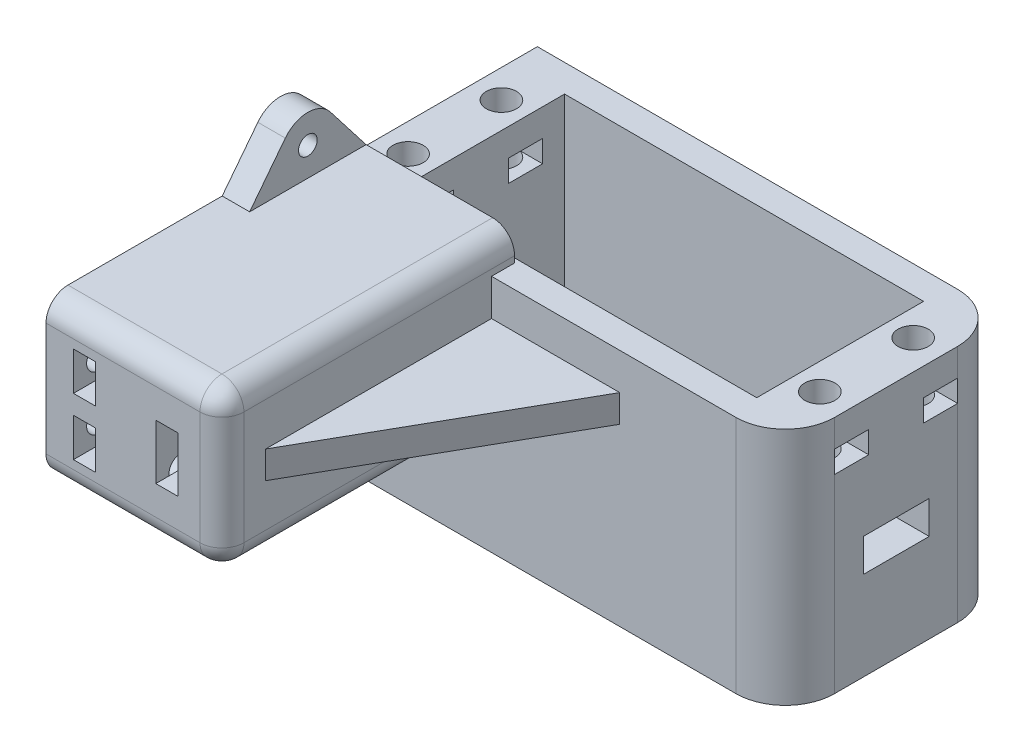
from build123d import *

# Parameters (mm, degrees)
BOSS_EXTRUDE1_DEPTH  = 12.572663867
SKETCH3_W            = 65.4
SKETCH3_H            = 30.4
BOSS_EXTRUDE2_DEPTH  = 43.572663867
FILLET1_R            = 9
SKETCH4_R            = 2.75
CUT_EXTRUDE1_DEPTH   = 20
CUT_EXTRUDE2_DEPTH   = 129
SKETCH6_R            = 6.7
CUT_EXTRUDE3_DEPTH   = 129
CUT_EXTRUDE6_DEPTH   = 63
SKETCH8_W            = 26.7
SKETCH8_H            = 1.112336133
BOSS_EXTRUDE3_DEPTH  = 4.2
BOSS_EXTRUDE4_DEPTH  = 41.15
SKETCH10_W           = 32.05
SKETCH10_H           = 5.146663352
BOSS_EXTRUDE5_DEPTH  = 4.2
BOSS_EXTRUDE6_DEPTH  = 23.35
CUT_EXTRUDE7_DEPTH   = 23.35
BOSS_EXTRUDE7_DEPTH  = 5
SKETCH15_W           = 32.05
SKETCH15_H           = 28.624452046
BOSS_EXTRUDE8_DEPTH  = 7.95
FILLET2_R            = 4
FILLET3_R            = 4
SKETCH16_R           = 2.2
CUT_EXTRUDE8_DEPTH   = 20
CUT_EXTRUDE9_DEPTH   = 41
BOSS_EXTRUDE9_DEPTH  = 5
SKETCH19_R           = 2.420474662
CUT_EXTRUDE10_DEPTH  = 5
BOSS_EXTRUDE10_START = -5
SKETCH20_R           = 2.420474662
SKETCH20_R_2         = 1.7
BOSS_EXTRUDE10_DEPTH = 5
SKETCH21_W           = 4
SKETCH21_H           = 10
CUT_EXTRUDE11_DEPTH  = 10


with BuildPart() as part:
    # Sketch2 → Boss-Extrude1 (new body)
    with BuildSketch(Plane.XZ):
        Polygon((-29.5, -30.2), (-32.5, -30.2), (-32.7, -30.2), (-32.7, -27), (-32.7, 0), (-32.7, 0.2), (32.5, 0.2), (32.7, 0.2), (32.900400589, -30.2), align=None)
    extrude(amount=BOSS_EXTRUDE1_DEPTH)

    # Sketch3 → Boss-Extrude2 (add)
    with BuildSketch(Plane(origin=(0, -12.572663867, 0), x_dir=(-1, 0, 0), z_dir=(0, -1, 0))):
        Polygon((-32.7, -5.2), (32.651437537, -5.2), (42.651437537, -5.2), (42.651437537, 30.2), (42.651437537, 35.2), (-32.900400589, 35.2), (-42.900400589, 35.2), (-42.900400589, 30.2), (-42.900400589, -5.2), align=None)
        with Locations((0, 15)):
            Rectangle(SKETCH3_W, SKETCH3_H, mode=Mode.SUBTRACT)
    extrude(amount=-BOSS_EXTRUDE2_DEPTH)

    # Fillet1
    fillet1_edges = [part.edges().sort_by_distance(p)[0] for p in [
        (42.900400589, 9.213668067, -35.2),
        (42.900400589, 9.213668067, 5.2),
    ]]
    fillet(fillet1_edges, radius=FILLET1_R)

    # Sketch4 → Cut-Extrude1 (cut)
    with BuildSketch(Plane(origin=(0, 31, 0), x_dir=(1, 0, 0), z_dir=(0, 1, 0))):
        with Locations(Location((-37.5, 23.5, 0), (0, 0, 270))):
            Circle(SKETCH4_R)
        with Locations(Location((-37.5, 6.5, 0), (0, 0, 270))):
            Circle(SKETCH4_R)
        with Locations(Location((37.5, 6.5, 0), (0, 0, 270))):
            Circle(SKETCH4_R)
        with Locations(Location((37.5, 23.5, 0), (0, 0, 270))):
            Circle(SKETCH4_R)
    extrude(amount=-CUT_EXTRUDE1_DEPTH, mode=Mode.SUBTRACT)

    # Sketch5 → Cut-Extrude2 (cut)
    with BuildSketch(Plane(origin=(42.900400589, 0, 0), x_dir=(0, 0, -1), z_dir=(1, 0, 0))):
        Polygon((6.5, 26), (3.8, 26), (3.8, 22), (10, 22), (10, 26), align=None)
        Polygon((26.2, 26), (23.5, 26), (20, 26), (20, 22), (26.2, 22), align=None)
    extrude(amount=-CUT_EXTRUDE2_DEPTH, mode=Mode.SUBTRACT)

    # Sketch6 → Cut-Extrude3 (cut)
    with BuildSketch(Plane.XZ.offset(12.572663867)):
        with Locations((19.5, -15)):
            Circle(SKETCH6_R)
    extrude(amount=-CUT_EXTRUDE3_DEPTH, mode=Mode.SUBTRACT)

    # Sketch7 → Cut-Extrude6 (cut)
    with BuildSketch(Plane(origin=(42.900400589, 0, 0), x_dir=(0, 0, -1), z_dir=(1, 0, 0))):
        Polygon((21.019628841, 3.612336133), (9.019628841, 3.612336133), (9.019628841, 9.612336133), (15.019628841, 9.612336133), (21.019628841, 9.612336133), align=None)
    extrude(amount=-CUT_EXTRUDE6_DEPTH, mode=Mode.SUBTRACT)

    # Sketch8 → Boss-Extrude3 (add)
    with BuildSketch(Plane.XY.offset(5.2)):
        with Locations((-29.301437537, 31.556168066)):
            Rectangle(SKETCH8_W, SKETCH8_H)
    extrude(amount=-BOSS_EXTRUDE3_DEPTH)

    # Sketch9 → Boss-Extrude4 (add)
    with BuildSketch(Plane.XY.offset(5.2)):
        Polygon((-15.951437537, 11.762336133), (-42.651437537, 11.762336133), (-42.651437537, 7.522211306), (-10.601437537, 7.522211306), (-10.601437537, 11.762336133), (-10.601437537, 31), (-15.601437537, 31), (-15.601437537, 11.762336133), align=None)
        Polygon((-42.651437537, 36.146663352), (-42.651437537, 32.462336133), (-15.601437537, 32.462336133), (-15.601437537, 32.112336133), (-15.601437537, 31), (-10.601437537, 31), (-10.601437537, 32.462336133), (-10.601437537, 36.146663352), align=None)
    extrude(amount=BOSS_EXTRUDE4_DEPTH)

    # Sketch10 → Boss-Extrude5 (add)
    with BuildSketch(Plane(origin=(0, 0, 5.2), x_dir=(-1, 0, 0), z_dir=(0, 0, -1))):
        with Locations((26.626437537, 33.573331676)):
            Rectangle(SKETCH10_W, SKETCH10_H)
    extrude(amount=BOSS_EXTRUDE5_DEPTH)

    # Sketch12 → Boss-Extrude6 (add)
    with BuildSketch(Plane(origin=(-10.601437537, 0, 0), x_dir=(0, 0, -1), z_dir=(1, 0, 0))):
        Polygon((-46.35, 21.834437329), (-46.35, 19.334437329), (-5.2, 19.334437329), (-5.2, 24.334437329), (-46.35, 24.334437329), align=None)
    extrude(amount=BOSS_EXTRUDE6_DEPTH)

    # Sketch13 → Cut-Extrude7 (cut)
    with BuildSketch(Plane(origin=(0, 24.334437329, 0), x_dir=(1, 0, 0), z_dir=(0, 1, 0))):
        Polygon((12.748562463, -5.2), (-10.601437537, -46.35), (12.748562463, -46.35), align=None)
    extrude(amount=-CUT_EXTRUDE7_DEPTH, mode=Mode.SUBTRACT)

    # Sketch14 → Boss-Extrude7 (add)
    with BuildSketch(Plane.ZY.offset(42.651437537)):
        Polygon((5.2, -12.572663867), (27.600666869, 7.522211306), (5.2, 7.522211306), align=None)
    extrude(amount=-BOSS_EXTRUDE7_DEPTH)

    # Sketch15 → Boss-Extrude8 (add)
    with BuildSketch(Plane.XY.offset(46.35)):
        with Locations((-26.626437537, 21.834437329)):
            Rectangle(SKETCH15_W, SKETCH15_H)
    extrude(amount=BOSS_EXTRUDE8_DEPTH)

    # Fillet2
    fillet2_edges = [part.edges().sort_by_distance(p)[0] for p in [
        (-10.601437537, 21.834437329, 54.3),
    ]]
    fillet(fillet2_edges, radius=FILLET2_R)

    # Fillet3
    fillet3_edges = [part.edges().sort_by_distance(p)[0] for p in [
        (-28.626437537, 7.522211306, 54.3),
        (-28.626437537, 36.146663352, 54.3),
        (-10.601437537, 36.146663352, 25.65),
        (-11.773010412, 36.146663352, 53.128427125),
        (-10.601437537, 7.522211306, 27.75),
        (-11.773010412, 7.522211306, 53.128427125),
    ]]
    fillet(fillet3_edges, radius=FILLET3_R)

    # Sketch16 → Cut-Extrude8 (cut)
    with BuildSketch(Plane.ZY.offset(42.651437537)):
        with Locations(Location((49.7, 27.062336133, 0), (0, 0, 270))):
            Circle(SKETCH16_R)
        with Locations(Location((49.7, 17.162336133, 0), (0, 0, 270))):
            Circle(SKETCH16_R)
        with Locations(Location((1.5, 27.062336133, 0), (0, 0, 270))):
            Circle(SKETCH16_R)
        with Locations(Location((1.5, 17.162336133, 0), (0, 0, 270))):
            Circle(SKETCH16_R)
    extrude(amount=-CUT_EXTRUDE8_DEPTH, mode=Mode.SUBTRACT)

    # Sketch17 → Cut-Extrude9 (cut)
    with BuildSketch(Plane.XY.offset(54.3)):
        Polygon((-33.651437537, 23.562336133), (-37.651437537, 23.562336133), (-37.651437537, 27.062336133), (-37.651437537, 30.562336133), (-33.651437537, 30.562336133), align=None)
        Polygon((-33.651437537, 20.106538525), (-37.651437537, 20.106538525), (-37.651437537, 16.606538525), (-37.651437537, 13.106538525), (-33.651437537, 13.106538525), align=None)
    extrude(amount=-CUT_EXTRUDE9_DEPTH, mode=Mode.SUBTRACT)

    # Sketch18 → Boss-Extrude9 (add)
    with BuildSketch(Plane.ZY.offset(42.651437537)):
        with BuildLine():
            Line((7.492385077, 44.529251739), (1, 36.146663352))
            Line((1, 36.146663352), (22.205551353, 36.146663352))
            Line((22.205551353, 36.146663352), (15.713166275, 44.529251739))
            ThreePointArc((15.713166275, 44.529251739), (11.602775676, 46.544776073), (7.492385077, 44.529251739))
        make_face()
        with BuildLine():
            ThreePointArc((11.602775676, 38.925245051), (9.891241629, 43.05725376), (14.023250338, 41.345719713))
            ThreePointArc((14.023250338, 41.345719713), (13.314309723, 39.634185666), (11.602775676, 38.925245051))
        make_face(mode=Mode.SUBTRACT)
    extrude(amount=-BOSS_EXTRUDE9_DEPTH)

    # Sketch19 → Cut-Extrude10 (cut)
    with BuildSketch(Plane.ZY.offset(42.651437537)):
        with Locations(Location((11.602775676, 2.878952554, 0), (0, 0, 270))):
            Circle(SKETCH19_R)
    extrude(amount=-CUT_EXTRUDE10_DEPTH, mode=Mode.SUBTRACT)

    # Sketch20 → Boss-Extrude10 (add)
    # profile 1 of 2: a face of its own
    with BuildSketch(Plane(origin=(-37.651437537, 0, 0), x_dir=(0, 0, -1), z_dir=(1, 0, 0)).offset(BOSS_EXTRUDE10_START)):
        with Locations((-11.602775676, 41.345719713)):
            Circle(SKETCH20_R)
        with Locations(Location((-11.602775676, 41.345719713, 0), (0, 0, 90))):
            Circle(SKETCH20_R_2, mode=Mode.SUBTRACT)
    # profile 2 of 2: a face of its own
    with BuildSketch(Plane(origin=(-37.651437537, 0, 0), x_dir=(0, 0, -1), z_dir=(1, 0, 0)).offset(BOSS_EXTRUDE10_START)):
        with Locations((-11.602775676, 2.878952554)):
            Circle(SKETCH20_R)
        with Locations(Location((-11.602775676, 2.878952554, 0), (0, 0, 90))):
            Circle(SKETCH20_R_2, mode=Mode.SUBTRACT)
    extrude(amount=BOSS_EXTRUDE10_DEPTH)

    # Sketch21 → Cut-Extrude11 (cut)
    with BuildSketch(Plane.XY.offset(54.3)):
        with Locations((-20.651437537, 21.834437329)):
            Rectangle(SKETCH21_W, SKETCH21_H)
    extrude(amount=-CUT_EXTRUDE11_DEPTH, mode=Mode.SUBTRACT)


solid = part.part
